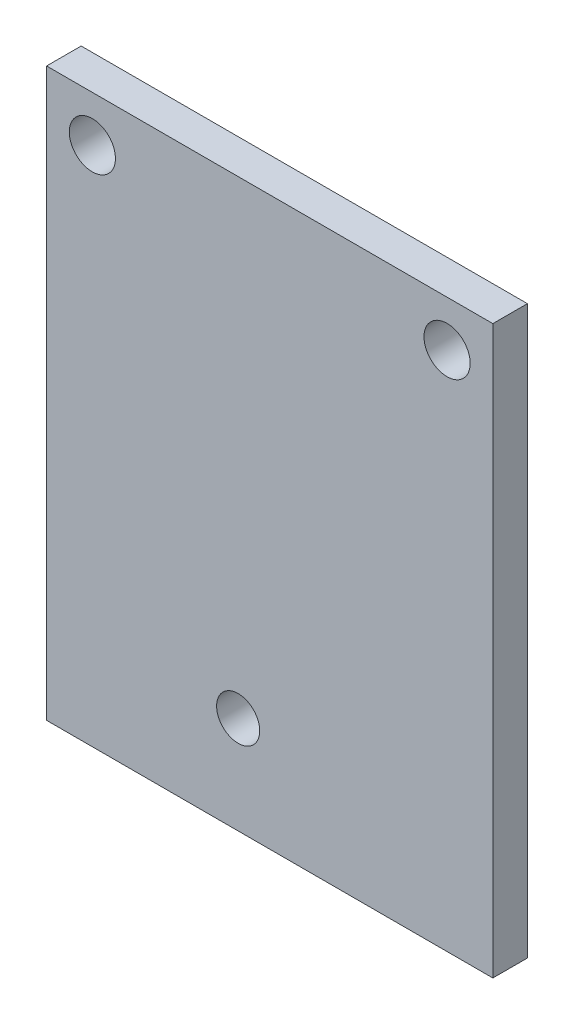
from build123d import *

# Parameters (mm, degrees)
SKETCH1_W           = 20.0000108
SKETCH1_H           = 25.4
BOSS_EXTRUDE1_DEPTH = 1.5494
SKETCH2_R           = 1.03505
SKETCH2_R_2         = 0.9652
CUT_EXTRUDE1_DEPTH  = 19.110379945


with BuildPart() as part:
    # Sketch1 → Boss-Extrude1 (new body)
    with BuildSketch(Plane.XY):
        with Locations((-0.2500054, -2.15)):
            Rectangle(SKETCH1_W, SKETCH1_H)
    extrude(amount=BOSS_EXTRUDE1_DEPTH)

    # Sketch2 → Cut-Extrude1 (cut, through all)
    with BuildSketch(Plane(origin=(0, 0, 0), x_dir=(-1, 0, 0), z_dir=(0, 0, -1))):
        with Locations((8.1989608, 8.49895)):
            Circle(SKETCH2_R)
        with Locations((-7.69895, 8.49895)):
            Circle(SKETCH2_R)
        with Locations((1.6648108, -10.4812)):
            Circle(SKETCH2_R_2)
    extrude(amount=-CUT_EXTRUDE1_DEPTH, mode=Mode.SUBTRACT)


solid = part.part
